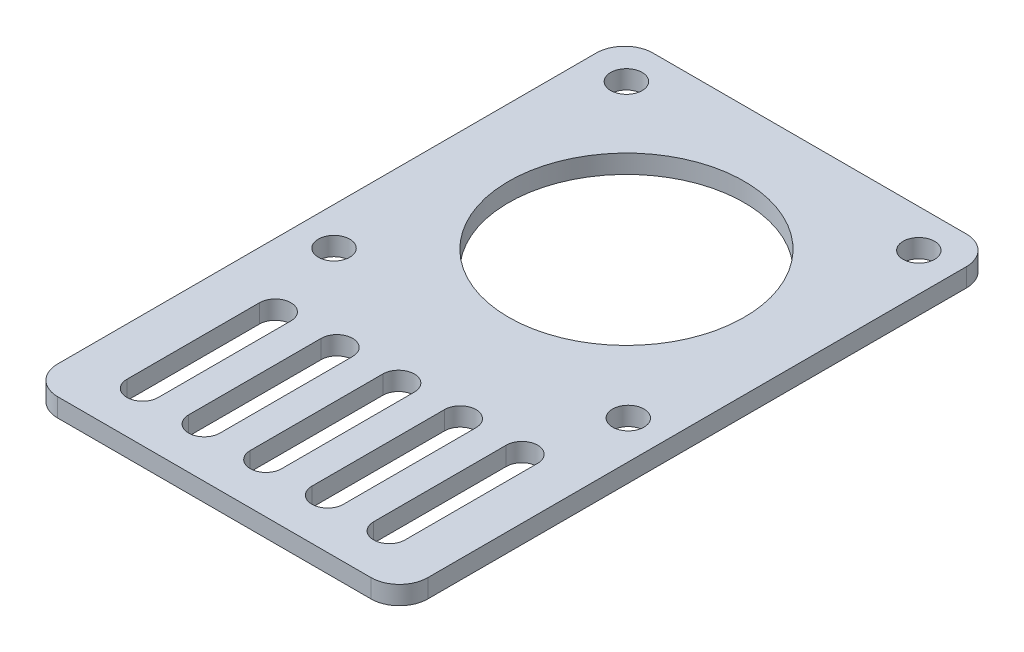
from build123d import *

# Parameters (mm, degrees)
SKETCH_1_R      = 2.55
SKETCH_1_R_2    = 19.1
EXTRUDE_1_DEPTH = 3


with BuildPart() as part:
    # Эскиз1 → Бобышка-Вытянуть1 (new body)
    with BuildSketch(Plane(origin=(0, 0, 0), x_dir=(1, 0, 0), z_dir=(0, 1, 0))):
        with BuildLine():
            Line((4.6, 0), (55.4, 0))
            ThreePointArc((55.4, 0), (58.652691193, -1.347308807), (60, -4.6))
            Line((60, -4.6), (60, -91.9))
            ThreePointArc((60, -91.9), (58.652691193, -95.152691193), (55.4, -96.5))
            Line((55.4, -96.5), (4.6, -96.5))
            ThreePointArc((4.6, -96.5), (1.347308807, -95.152691193), (0, -91.9))
            Line((0, -91.9), (0, -4.6))
            ThreePointArc((0, -4.6), (1.347308807, -1.347308807), (4.6, 0))
        make_face()
        with Locations(Location((6.45, -6.15, 0), (0, 0, 270))):
            Circle(SKETCH_1_R, mode=Mode.SUBTRACT)
        with Locations(Location((53.85, -6.15, 0), (0, 0, 270))):
            Circle(SKETCH_1_R, mode=Mode.SUBTRACT)
        with Locations(Location((6.15, -53.25, 0), (0, 0, 270))):
            Circle(SKETCH_1_R, mode=Mode.SUBTRACT)
        with Locations(Location((53.85, -53.25, 0), (0, 0, 270))):
            Circle(SKETCH_1_R, mode=Mode.SUBTRACT)
        with Locations(Location((30, -29.7, 0), (0, 0, 270))):
            Circle(SKETCH_1_R_2, mode=Mode.SUBTRACT)
        with BuildLine():
            Line((12.861404853, -66.95), (12.861404853, -88.45))
            ThreePointArc((12.861404853, -88.45), (10.311404853, -91), (7.761404853, -88.45))
            Line((7.761404853, -88.45), (7.761404853, -66.95))
            ThreePointArc((7.761404853, -66.95), (10.311404853, -64.4), (12.861404853, -66.95))
        make_face(mode=Mode.SUBTRACT)
        with BuildLine():
            Line((22.861404853, -66.95), (22.861404853, -88.45))
            ThreePointArc((22.861404853, -88.45), (20.311404853, -91), (17.761404853, -88.45))
            Line((17.761404853, -88.45), (17.761404853, -66.95))
            ThreePointArc((17.761404853, -66.95), (20.311404853, -64.4), (22.861404853, -66.95))
        make_face(mode=Mode.SUBTRACT)
        with BuildLine():
            Line((32.861404853, -66.95), (32.861404853, -88.45))
            ThreePointArc((32.861404853, -88.45), (30.311404853, -91), (27.761404853, -88.45))
            Line((27.761404853, -88.45), (27.761404853, -66.95))
            ThreePointArc((27.761404853, -66.95), (30.311404853, -64.4), (32.861404853, -66.95))
        make_face(mode=Mode.SUBTRACT)
        with BuildLine():
            Line((42.861404853, -66.95), (42.861404853, -88.45))
            ThreePointArc((42.861404853, -88.45), (40.311404853, -91), (37.761404853, -88.45))
            Line((37.761404853, -88.45), (37.761404853, -66.95))
            ThreePointArc((37.761404853, -66.95), (40.311404853, -64.4), (42.861404853, -66.95))
        make_face(mode=Mode.SUBTRACT)
        with BuildLine():
            Line((52.861404853, -66.95), (52.861404853, -88.45))
            ThreePointArc((52.861404853, -88.45), (50.311404853, -91), (47.761404853, -88.45))
            Line((47.761404853, -88.45), (47.761404853, -66.95))
            ThreePointArc((47.761404853, -66.95), (50.311404853, -64.4), (52.861404853, -66.95))
        make_face(mode=Mode.SUBTRACT)
    extrude(amount=EXTRUDE_1_DEPTH)


solid = part.part
